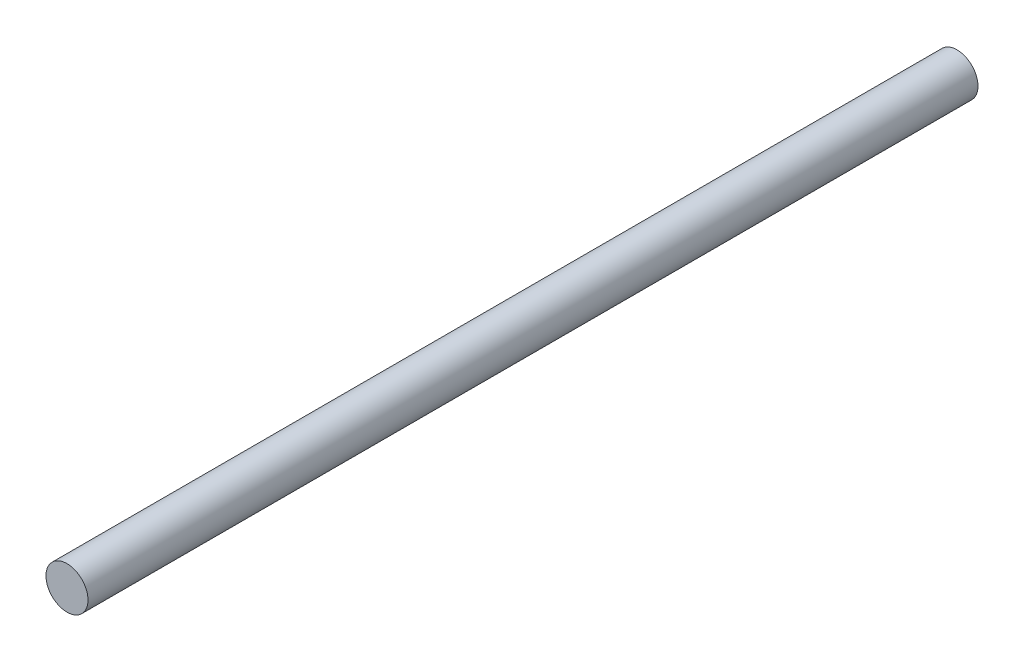
from build123d import *

# Parameters (mm, degrees)
SKETCH1_R           = 3
BOSS_EXTRUDE1_DEPTH = 127


with BuildPart() as part:
    # Sketch1 → Boss-Extrude1 (new body)
    with BuildSketch(Plane.XY):
        Circle(SKETCH1_R)
    extrude(amount=BOSS_EXTRUDE1_DEPTH)


solid = part.part
